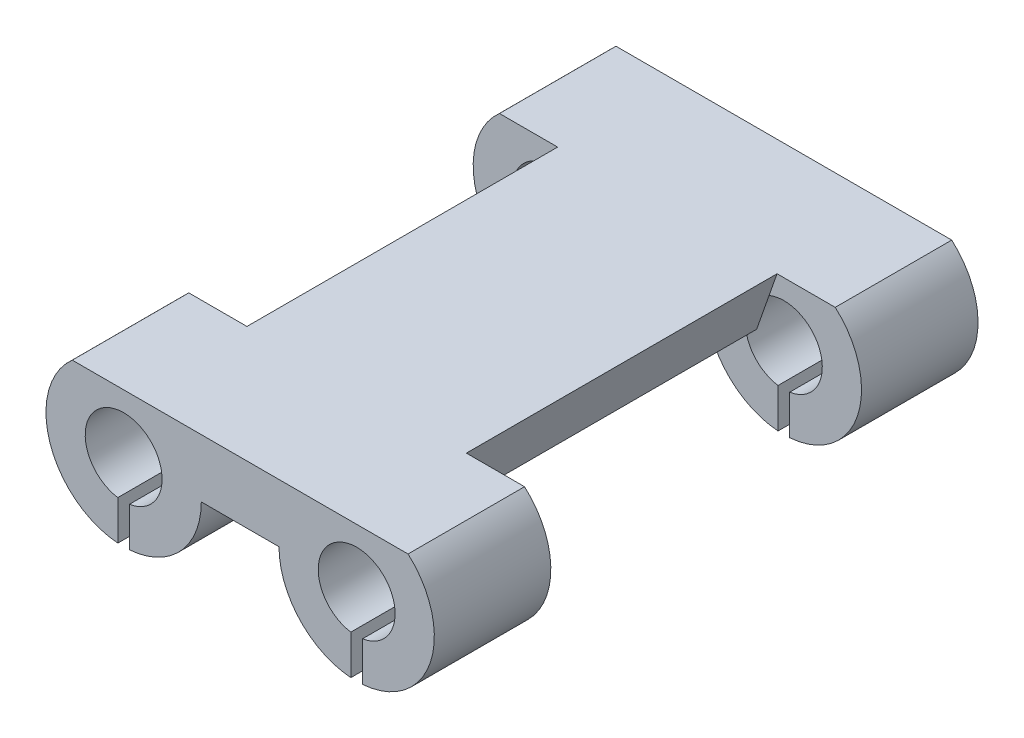
from build123d import *

# Parameters (mm, degrees)
BOSS_EXTRUDE1_DEPTH = 15
BOSS_EXTRUDE2_DEPTH = 40
BOSS_EXTRUDE3_DEPTH = 15
SKETCH5_R           = 4.95
CUT_EXTRUDE1_DEPTH  = 15
CUT_EXTRUDE2_START  = -15
SKETCH6_R           = 4.95
CUT_EXTRUDE2_DEPTH  = 15
SKETCH7_W           = 1.5
SKETCH7_H           = 10
CUT_EXTRUDE3_DEPTH  = 76
SKETCH8_W           = 50
SKETCH8_H           = 2.5
CUT_EXTRUDE4_DEPTH  = 76


with BuildPart() as part:
    # Sketch2 → Boss-Extrude1 (new body)
    with BuildSketch(Plane.XY):
        with BuildLine():
            Line((-5, 10), (-15, 10))
            ThreePointArc((-15, 10), (-22.071067812, -7.071067812), (-5, 0))
            Line((-5, 0), (5, 0))
            ThreePointArc((5, 0), (22.071067812, -7.071067812), (15, 10))
            Line((15, 10), (5, 10))
            Line((5, 10), (-5, 10))
        make_face()
    extrude(amount=BOSS_EXTRUDE1_DEPTH)

    # Sketch3 → Boss-Extrude2 (add)
    with BuildSketch(Plane.XY.offset(15)):
        Polygon((-11.5, 0), (-15, 10), (15, 10), (11.5, 0), align=None)
    extrude(amount=BOSS_EXTRUDE2_DEPTH)

    # Sketch4 → Boss-Extrude3 (add)
    with BuildSketch(Plane.XY.offset(55)):
        with BuildLine():
            Line((-5, 10), (-15, 10))
            ThreePointArc((-15, 10), (-22.071067812, -7.071067812), (-5, 0))
            Line((-5, 0), (5, 0))
            ThreePointArc((5, 0), (22.071067812, -7.071067812), (15, 10))
            Line((15, 10), (5, 10))
            Line((5, 10), (-5, 10))
        make_face()
    extrude(amount=BOSS_EXTRUDE3_DEPTH)

    # Sketch5 → Cut-Extrude1 (cut)
    with BuildSketch(Plane(origin=(0, 0, 0), x_dir=(-1, 0, 0), z_dir=(0, 0, -1))):
        with Locations((15, 0)):
            Circle(SKETCH5_R)
        with Locations((-15, 0)):
            Circle(SKETCH5_R)
    extrude(amount=-CUT_EXTRUDE1_DEPTH, mode=Mode.SUBTRACT)

    # Sketch6 → Cut-Extrude2 (cut)
    with BuildSketch(Plane.XY.offset(70).offset(CUT_EXTRUDE2_START)):
        with Locations(Location((-15, 0, 0), (0, 0, 180))):
            Circle(SKETCH6_R)
        with Locations(Location((15, 0, 0), (0, 0, 180))):
            Circle(SKETCH6_R)
    extrude(amount=CUT_EXTRUDE2_DEPTH, mode=Mode.SUBTRACT)

    # Sketch7 → Cut-Extrude3 (cut, through all)
    with BuildSketch(Plane.XY.offset(70)):
        with Locations((-15, -5)):
            Rectangle(SKETCH7_W, SKETCH7_H)
        with Locations((15, -5)):
            Rectangle(SKETCH7_W, SKETCH7_H)
    extrude(amount=-CUT_EXTRUDE3_DEPTH, mode=Mode.SUBTRACT)

    # Sketch8 → Cut-Extrude4 (cut, through all)
    with BuildSketch(Plane(origin=(0, 0, 0), x_dir=(-1, 0, 0), z_dir=(0, 0, -1))):
        with Locations((0, 8.75)):
            Rectangle(SKETCH8_W, SKETCH8_H)
    extrude(amount=-CUT_EXTRUDE4_DEPTH, mode=Mode.SUBTRACT)


solid = part.part
